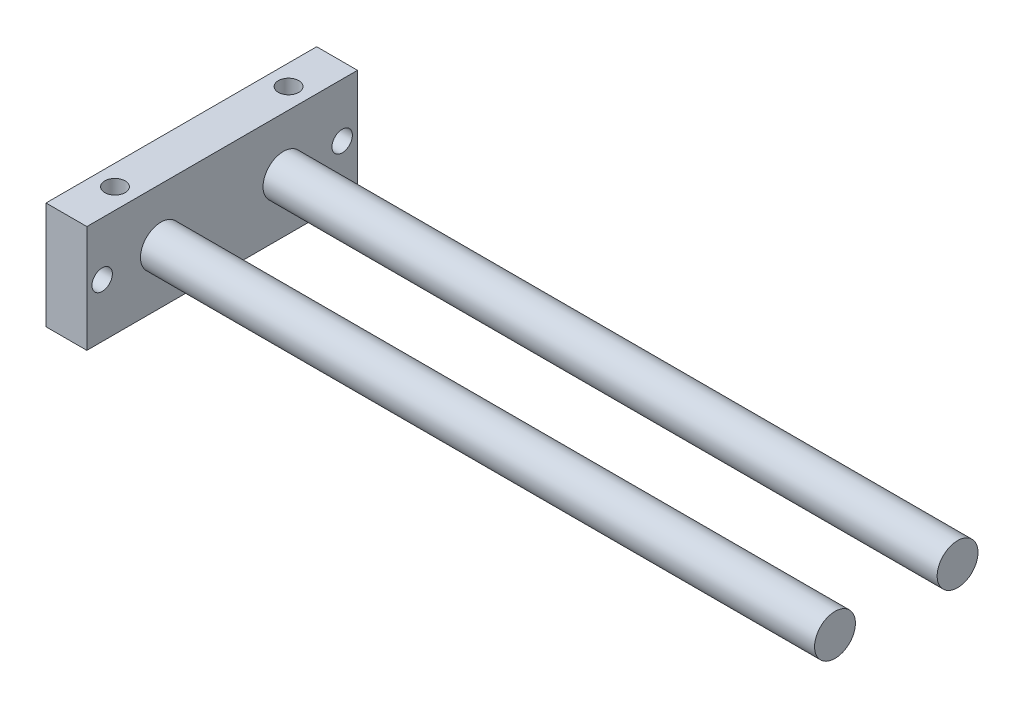
from build123d import *

# Parameters (mm, degrees)
SKETCH_1_W          = 53
SKETCH_1_H          = 21
SKETCH_1_R          = 2
EXTRUDE_1_DEPTH     = 8
SKETCH_2_R          = 4
CUT_EXTRUDE_1_DEPTH = 5
SKETCH_3_R          = 4
EXTRUDE_2_DEPTH     = 132
SKETCH_4_R          = 2
CUT_EXTRUDE_2_DEPTH = 5


with BuildPart() as part:
    # 草图1 → 凸台-拉伸1 (new body)
    with BuildSketch(Plane(origin=(0, 0, 0), x_dir=(0, 0, -1), z_dir=(1, 0, 0))):
        with Locations((26.5, 10.5)):
            Rectangle(SKETCH_1_W, SKETCH_1_H)
        with Locations((50, 10.5)):
            Circle(SKETCH_1_R, mode=Mode.SUBTRACT)
        with Locations(Location((3, 10.5, 0), (0, 0, 180))):
            Circle(SKETCH_1_R, mode=Mode.SUBTRACT)
    extrude(amount=EXTRUDE_1_DEPTH)

    # 草图2 → 切除-拉伸1 (cut)
    with BuildSketch(Plane.ZY):
        with Locations((-14.5, 10.5)):
            Circle(SKETCH_2_R)
        with Locations(Location((-38.5, 10.5, 0), (0, 0, 180))):
            Circle(SKETCH_2_R)
    extrude(amount=-CUT_EXTRUDE_1_DEPTH, mode=Mode.SUBTRACT)

    # 草图3 → 凸台-拉伸2 (add)
    with BuildSketch(Plane(origin=(8, 0, 0), x_dir=(0, 0, -1), z_dir=(1, 0, 0))):
        with Locations((38.5, 10.5)):
            Circle(SKETCH_3_R)
        with Locations(Location((14.5, 10.5, 0), (0, 0, 180))):
            Circle(SKETCH_3_R)
    extrude(amount=EXTRUDE_2_DEPTH)

    # 草图4 → 切除-拉伸2 (cut)
    with BuildSketch(Plane(origin=(0, 21, 0), x_dir=(1, 0, 0), z_dir=(0, 1, 0))):
        with Locations(Location((4, 43.5, 0), (0, 0, 270))):
            Circle(SKETCH_4_R)
        with Locations(Location((4, 9.5, 0), (0, 0, 90))):
            Circle(SKETCH_4_R)
    extrude(amount=-CUT_EXTRUDE_2_DEPTH, mode=Mode.SUBTRACT)


solid = part.part
